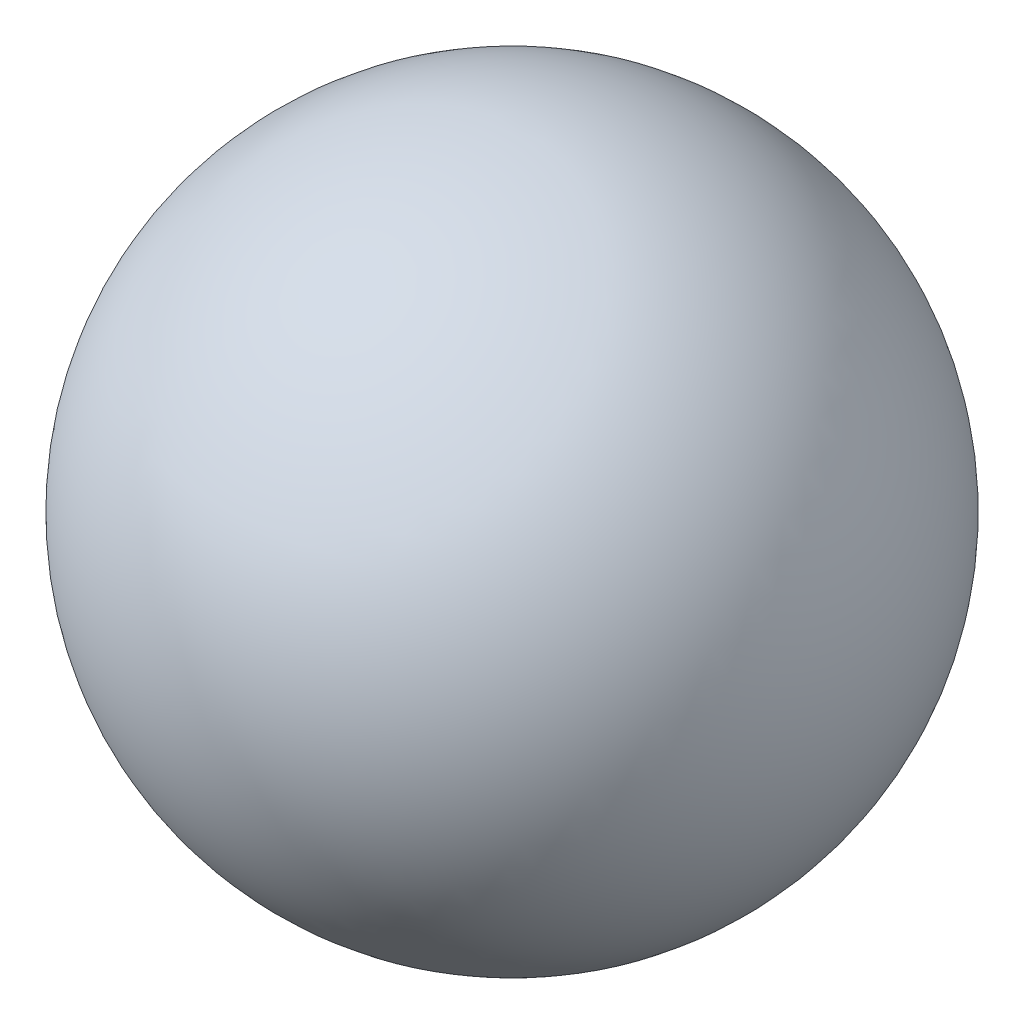
from build123d import *


with BuildPart() as part:
    # Sketch1 → Revolve1 (revolve)
    with BuildSketch(Plane(origin=(0, 0, 0), x_dir=(-1, 0, 0), z_dir=(0, 0, -1))):
        with BuildLine():
            Line((0, 3.209989756), (0, 4.727510244))
            ThreePointArc((0, 4.727510244), (-0.758760244, 3.96875), (0, 3.209989756))
        make_face()
    revolve(axis=Axis((0, 3.209989756, 0), (0, 1, 0)))


solid = part.part
